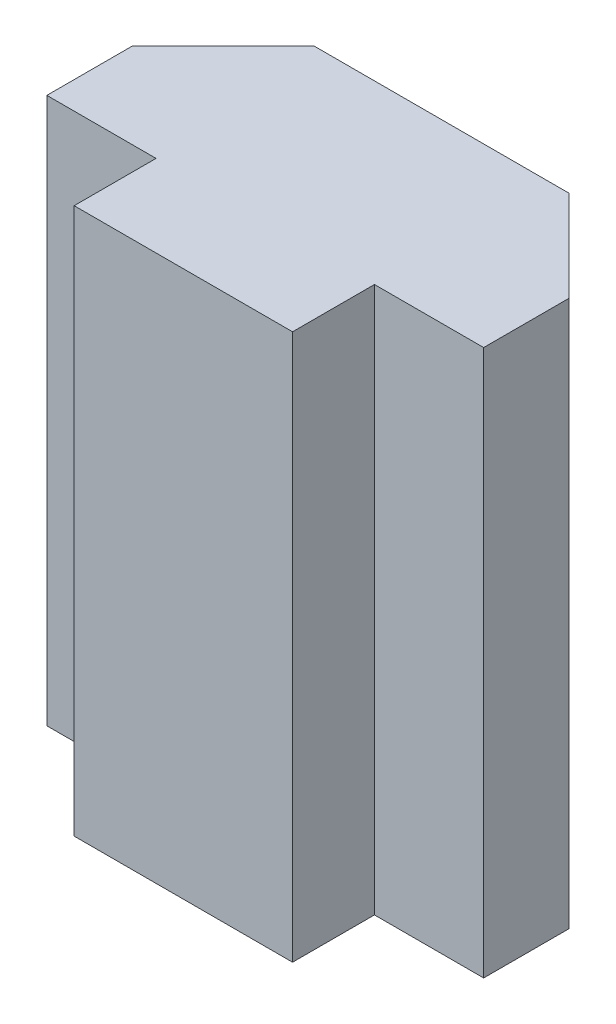
from build123d import *

# Parameters (mm, degrees)
BOSS_EXTRUDE1_DEPTH          = 40
SKETCH2_W                    = 3.5
SKETCH2_H                    = 40
BOSS_EXTRUDE2_DEPTH          = 5
SKETCH4_R                    = 2
CUT_EXTRUDE1_DEPTH           = 7
SKETCH5_R                    = 3.5
CUT_EXTRUDE2_DEPTH           = 3
CUT_EXTRUDE2_DRAFT           = -27
CUT_EXTRUDE2_PROFILE_2_DEPTH = 3
CUT_EXTRUDE2_PROFILE_2_DRAFT = -27
BOSS_EXTRUDE3_DEPTH          = 3
SKETCH9_W                    = 13
SKETCH9_H                    = 40
CUT_EXTRUDE4_DEPTH           = 4.702585656
SKETCH10_W                   = 15
SKETCH10_H                   = 40
BOSS_EXTRUDE4_DEPTH          = 2.5
SKETCH11_W                   = 1.5
SKETCH11_H                   = 2.202585656
BOSS_EXTRUDE7_DEPTH          = 40
BOSS_EXTRUDE8_DEPTH          = 0.625841469
SKETCH13_R                   = 2
CUT_EXTRUDE5_DEPTH           = 10
SKETCH14_W                   = 2.5
SKETCH14_H                   = 40
BOSS_EXTRUDE9_DEPTH          = 0.5
SKETCH15_W                   = 2.5
SKETCH15_H                   = 40
BOSS_EXTRUDE10_DEPTH         = 0.5
BOSS_EXTRUDE11_DEPTH         = 40
BOSS_EXTRUDE12_DEPTH         = 1.13137085
SKETCH18_R                   = 2
CUT_EXTRUDE6_DEPTH           = 10
SKETCH19_R                   = 3
CUT_EXTRUDE7_DEPTH           = 3
CUT_EXTRUDE7_DRAFT           = -19
CUT_EXTRUDE7_PROFILE_2_DEPTH = 3
CUT_EXTRUDE7_PROFILE_2_DRAFT = -19
SKETCH20_W                   = 5
SKETCH20_H                   = 40
BOSS_EXTRUDE13_DEPTH         = 0.5
SKETCH21_W                   = 5
SKETCH21_H                   = 40
BOSS_EXTRUDE14_DEPTH         = 0.5
SKETCH22_W                   = 7
SKETCH22_H                   = 6.5
SKETCH22_W_2                 = 7.5
CUT_EXTRUDE8_DEPTH           = 20
SKETCH23_R                   = 2
BOSS_EXTRUDE15_DEPTH         = 6.459797975
BOSS_EXTRUDE16_START         = -11.459798
SKETCH24_R                   = 3
BOSS_EXTRUDE16_DEPTH         = 11.459798
SKETCH25_W                   = 4
SKETCH25_H                   = 20
CUT_EXTRUDE9_DEPTH           = 20
SKETCH26_W                   = 8
SKETCH26_H                   = 20
CUT_EXTRUDE10_DEPTH          = 1
SKETCH28_W                   = 8
SKETCH28_H                   = 20
CUT_EXTRUDE11_DEPTH          = 1


with BuildPart() as part:
    # Sketch1 → Boss-Extrude1 (new body)
    with BuildSketch(Plane(origin=(0, 0, 0), x_dir=(1, 0, 0), z_dir=(0, 1, 0))):
        Polygon((-4.247892457, 4.702585656), (8.752107543, 4.702585656), (8.752107543, 1.702585656), (7.049521887, 0), (-2.545306801, 0), (-4.247892457, 1.702585656), align=None)
    extrude(amount=BOSS_EXTRUDE1_DEPTH)

    # Sketch2 → Boss-Extrude2 (add)
    with BuildSketch(Plane.XY):
        with Locations((4.002107543, 20)):
            Rectangle(SKETCH2_W, SKETCH2_H)
        with Locations((0.502107543, 20)):
            Rectangle(SKETCH2_W, SKETCH2_H)
    extrude(amount=BOSS_EXTRUDE2_DEPTH)

    # Sketch4 → Cut-Extrude1 (cut)
    with BuildSketch(Plane.XY.offset(5)):
        with Locations((2.252107543, 30)):
            Circle(SKETCH4_R)
        with Locations((2.252107543, 10)):
            Circle(SKETCH4_R)
    extrude(amount=-CUT_EXTRUDE1_DEPTH, mode=Mode.SUBTRACT)


with BuildPart() as cut_extrude2_tool:
    # Sketch5 → Cut-Extrude2 (with draft: the straight prism first)
    with BuildSketch(Plane(origin=(0, 0, -4.702585656), x_dir=(-1, 0, 0), z_dir=(0, 0, -1))):
        with Locations((-2.252107543, 30)):
            Circle(SKETCH5_R)
    extrude(amount=-CUT_EXTRUDE2_DEPTH)
    # Cut-Extrude2: the draft: its side faces are tilted about the plane it starts from
    cut_extrude2_sides = [cut_extrude2_tool.faces().sort_by_distance(p)[0] for p in [
        (5.752107543, 30, -3.202585656),
    ]]
    draft(cut_extrude2_sides, Plane(origin=(0, 0, -4.702585656), x_dir=(-1, 0, 0), z_dir=(0, 0, -1)), CUT_EXTRUDE2_DRAFT)


with BuildPart() as part_1:
    add(part.part)

    # Cut-Extrude2: cut by cut_extrude2_tool
    add(cut_extrude2_tool.part, mode=Mode.SUBTRACT)


with BuildPart() as cut_extrude2_profile_2_tool:
    # Sketch5 → Cut-Extrude2 profile 2 (with draft: the straight prism first)
    with BuildSketch(Plane(origin=(0, 0, -4.702585656), x_dir=(-1, 0, 0), z_dir=(0, 0, -1))):
        with Locations((-2.252107543, 10)):
            Circle(SKETCH5_R)
    extrude(amount=-CUT_EXTRUDE2_PROFILE_2_DEPTH)
    # Cut-Extrude2 profile 2: the draft: its side faces are tilted about the plane it starts from
    cut_extrude2_profile_2_sides = [cut_extrude2_profile_2_tool.faces().sort_by_distance(p)[0] for p in [
        (5.752107543, 10, -3.202585656),
    ]]
    draft(cut_extrude2_profile_2_sides, Plane(origin=(0, 0, -4.702585656), x_dir=(-1, 0, 0), z_dir=(0, 0, -1)), CUT_EXTRUDE2_PROFILE_2_DRAFT)


with BuildPart() as part_2:
    add(part_1.part)

    # Cut-Extrude2 profile 2: cut by cut_extrude2_profile_2_tool
    add(cut_extrude2_profile_2_tool.part, mode=Mode.SUBTRACT)

    # Sketch7 → Boss-Extrude3 (add)
    with BuildSketch(Plane(origin=(0, 0, -4.702585656), x_dir=(-1, 0, 0), z_dir=(0, 0, -1))):
        Polygon((1.247892457, 46.5), (-5.752107543, 46.5), (-5.752107543, 40), (-4.252107543, 40), (-4.252107543, 45), (-0.252107543, 45), (-0.252107543, 43.275204256), (-0.252107543, 40), (1.247892457, 40), align=None)
        Polygon((-4.252107543, 0), (-5.752107543, 0), (-5.752107543, -6.5), (1.247892457, -6.5), (1.247892457, 0), (-0.252107543, 0), (-0.252107543, -5), (-4.252107543, -5), align=None)
    extrude(amount=-BOSS_EXTRUDE3_DEPTH)

    # Sketch9 → Cut-Extrude4 (cut)
    with BuildSketch(Plane(origin=(0, 0, -4.702585656), x_dir=(-1, 0, 0), z_dir=(0, 0, -1))):
        with Locations((-2.252107543, 20)):
            Rectangle(SKETCH9_W, SKETCH9_H)
    extrude(amount=-CUT_EXTRUDE4_DEPTH, mode=Mode.SUBTRACT)


with BuildPart() as cut_extrude4_piece_1:
    # of the separate pieces the step leaves, piece 1, a body of its own (cut_extrude4_pieces)
    add(part_2.part.solids().sort_by_distance((-1.247892457, 0, 0))[0])



with BuildPart() as cut_extrude4_piece_2:
    # of the separate pieces the step leaves, piece 2, a body of its own (cut_extrude4_pieces)
    add(part_2.part.solids().sort_by_distance((0.252107543, 40, -4.702585656))[0])


with BuildPart() as cut_extrude4_piece_3:
    # of the separate pieces the step leaves, piece 3, a body of its own (cut_extrude4_pieces)
    add(part_2.part.solids().sort_by_distance((-1.247892457, -6.5, -4.702585656))[0])


with BuildPart() as cut_extrude4_piece_1_1:
    add(cut_extrude4_piece_1.part)

    add(cut_extrude4_piece_2.part)  # Boss-Extrude4 merges Cut-Extrude4 piece 2

    add(cut_extrude4_piece_3.part)  # Boss-Extrude4 merges Cut-Extrude4 piece 3
    # Sketch10 → Boss-Extrude4 (add)
    with BuildSketch(Plane(origin=(0, 0, 0), x_dir=(-1, 0, 0), z_dir=(0, 0, -1))):
        with Locations((-2.252107543, 20)):
            Rectangle(SKETCH10_W, SKETCH10_H)
    extrude(amount=BOSS_EXTRUDE4_DEPTH)

    # Sketch11 → Boss-Extrude7 (add)
    with BuildSketch(Plane(origin=(0, 0, 0), x_dir=(1, 0, 0), z_dir=(0, 1, 0))):
        with Locations((5.002107543, 3.601292828)):
            Rectangle(SKETCH11_W, SKETCH11_H)
        Polygon((-2.419465332, 5.328427125), (-5.247892457, 2.5), (4.252107543, 2.5), (4.252107543, 4.702585656), (5.752107543, 4.702585656), (5.752107543, 2.5), (9.752107543, 2.5), (6.923680418, 5.328427125), align=None)
    extrude(amount=BOSS_EXTRUDE7_DEPTH)

    # Sketch12 → Boss-Extrude8 (add)
    with BuildSketch(Plane(origin=(0, 0, -4.702585656), x_dir=(-1, 0, 0), z_dir=(0, 0, -1))):
        Polygon((-5.752107543, 0), (-5.752107543, -6.5), (1.247892457, -6.5), (1.247892457, 0), (-0.252107543, 0), (-0.252107543, -5), (-4.252107543, -5), (-4.252107543, 0), align=None)
        Polygon((1.247892457, 46.5), (-5.752107543, 46.5), (-5.752107543, 40), (-4.252107543, 40), (-4.252107543, 45), (-0.252107543, 45), (-0.252107543, 40), (1.247892457, 40), align=None)
    extrude(amount=BOSS_EXTRUDE8_DEPTH)

    # Sketch13 → Cut-Extrude5 (cut)
    with BuildSketch(Plane.XY):
        with Locations((2.252107543, 30)):
            Circle(SKETCH13_R)
        with Locations((2.252107543, 10)):
            Circle(SKETCH13_R)
    extrude(amount=-CUT_EXTRUDE5_DEPTH, mode=Mode.SUBTRACT)

    # Sketch14 → Boss-Extrude9 (add)
    with BuildSketch(Plane(origin=(9.752107543, 0, 0), x_dir=(0, 0, -1), z_dir=(1, 0, 0))):
        with Locations((1.25, 20)):
            Rectangle(SKETCH14_W, SKETCH14_H)
    extrude(amount=BOSS_EXTRUDE9_DEPTH)

    # Sketch15 → Boss-Extrude10 (add)
    with BuildSketch(Plane.ZY.offset(5.247892457)):
        with Locations((-1.25, 20)):
            Rectangle(SKETCH15_W, SKETCH15_H)
    extrude(amount=BOSS_EXTRUDE10_DEPTH)

    # Sketch16 → Boss-Extrude11 (add)
    with BuildSketch(Plane.XZ):
        Polygon((-2.419465332, -5.328427125), (-5.247892457, -2.5), (-5.747892457, -2.5), (-5.747892457, -3.13137085), (-2.419465332, -6.459797975), (6.923680418, -6.459797975), (10.252107543, -3.13137085), (10.252107543, -2.5), (9.752107543, -2.5), (6.923680418, -5.328427125), (0.656985658, -5.328427125), align=None)
    extrude(amount=-BOSS_EXTRUDE11_DEPTH)

    # Sketch17 → Boss-Extrude12 (add)
    with BuildSketch(Plane(origin=(0, 0, -5.328427125), x_dir=(-1, 0, 0), z_dir=(0, 0, -1))):
        Polygon((-5.752107543, 0), (-5.752107543, -6.5), (1.247892457, -6.5), (1.247892457, 0), (0, 0), (0, -5), (-0.252107543, -5), (-4.252107543, -5), (-4.252107543, 0), align=None)
        Polygon((1.247892457, 46.5), (-5.752107543, 46.5), (-5.752107543, 40), (-4.252107543, 40), (-4.252107543, 44.953142187), (-0.252107543, 44.953142187), (-0.252107543, 40), (1.247892457, 40), align=None)
    extrude(amount=BOSS_EXTRUDE12_DEPTH)

    # Sketch18 → Cut-Extrude6 (cut)
    with BuildSketch(Plane.XY.offset(-5.328427125)):
        with Locations((2.252107543, 30)):
            Circle(SKETCH18_R)
        with Locations((2.252107543, 10)):
            Circle(SKETCH18_R)
    extrude(amount=-CUT_EXTRUDE6_DEPTH, mode=Mode.SUBTRACT)


with BuildPart() as cut_extrude7_tool:
    # Sketch19 → Cut-Extrude7 (with draft: the straight prism first)
    with BuildSketch(Plane(origin=(0, 0, -6.459797975), x_dir=(-1, 0, 0), z_dir=(0, 0, -1))):
        with Locations((-2.252107543, 30)):
            Circle(SKETCH19_R)
    extrude(amount=-CUT_EXTRUDE7_DEPTH)
    # Cut-Extrude7: the draft: its side faces are tilted about the plane it starts from
    cut_extrude7_sides = [cut_extrude7_tool.faces().sort_by_distance(p)[0] for p in [
        (5.252107543, 30, -4.959797975),
    ]]
    draft(cut_extrude7_sides, Plane(origin=(0, 0, -6.459797975), x_dir=(-1, 0, 0), z_dir=(0, 0, -1)), CUT_EXTRUDE7_DRAFT)


with BuildPart() as cut_extrude4_piece_1_2:
    add(cut_extrude4_piece_1_1.part)

    # Cut-Extrude7: cut by cut_extrude7_tool
    add(cut_extrude7_tool.part, mode=Mode.SUBTRACT)


with BuildPart() as cut_extrude7_profile_2_tool:
    # Sketch19 → Cut-Extrude7 profile 2 (with draft: the straight prism first)
    with BuildSketch(Plane(origin=(0, 0, -6.459797975), x_dir=(-1, 0, 0), z_dir=(0, 0, -1))):
        with Locations((-2.252107543, 10)):
            Circle(SKETCH19_R)
    extrude(amount=-CUT_EXTRUDE7_PROFILE_2_DEPTH)
    # Cut-Extrude7 profile 2: the draft: its side faces are tilted about the plane it starts from
    cut_extrude7_profile_2_sides = [cut_extrude7_profile_2_tool.faces().sort_by_distance(p)[0] for p in [
        (5.252107543, 10, -4.959797975),
    ]]
    draft(cut_extrude7_profile_2_sides, Plane(origin=(0, 0, -6.459797975), x_dir=(-1, 0, 0), z_dir=(0, 0, -1)), CUT_EXTRUDE7_PROFILE_2_DRAFT)


with BuildPart() as cut_extrude4_piece_1_3:
    add(cut_extrude4_piece_1_2.part)

    # Cut-Extrude7 profile 2: cut by cut_extrude7_profile_2_tool
    add(cut_extrude7_profile_2_tool.part, mode=Mode.SUBTRACT)

    # Sketch20 → Boss-Extrude13 (add)
    with BuildSketch(Plane.ZY.offset(1.247892457)):
        with Locations((2.5, 20)):
            Rectangle(SKETCH20_W, SKETCH20_H)
    extrude(amount=BOSS_EXTRUDE13_DEPTH)

    # Sketch21 → Boss-Extrude14 (add)
    with BuildSketch(Plane(origin=(5.752107543, 0, 0), x_dir=(0, 0, -1), z_dir=(1, 0, 0))):
        with Locations((-2.5, 20)):
            Rectangle(SKETCH21_W, SKETCH21_H)
    extrude(amount=BOSS_EXTRUDE14_DEPTH)

    # Sketch22 → Cut-Extrude8 (cut)
    with BuildSketch(Plane.XY.offset(5)):
        with Locations((2.252107543, 43.25)):
            Rectangle(SKETCH22_W, SKETCH22_H)
        with Locations((2.502107543, -3.25)):
            Rectangle(SKETCH22_W_2, SKETCH22_H)
    extrude(amount=-CUT_EXTRUDE8_DEPTH, mode=Mode.SUBTRACT)

    # Sketch23 → Boss-Extrude15 (add)
    with BuildSketch(Plane.XY):
        with Locations((2.252107543, 10)):
            Circle(SKETCH23_R)
        with Locations((2.252107543, 30)):
            Circle(SKETCH23_R)
    extrude(amount=-BOSS_EXTRUDE15_DEPTH)

    # Sketch24 → Boss-Extrude16 (add)
    with BuildSketch(Plane(origin=(0, 0, -6.459797975), x_dir=(-1, 0, 0), z_dir=(0, 0, -1)).offset(BOSS_EXTRUDE16_START)):
        with Locations((-2.252107543, 30)):
            Circle(SKETCH24_R)
        with Locations((-2.252107543, 10)):
            Circle(SKETCH24_R)
    extrude(amount=BOSS_EXTRUDE16_DEPTH)

    # Sketch25 → Cut-Extrude9 (cut)
    with BuildSketch(Plane.XY.offset(5)):
        Polygon((6.252107543, 20.358230215), (6.252107543, 20), (10.252107543, 20), (10.252107543, 40), (6.252107543, 40), align=None)
        Polygon((-1.747892457, 20), (6.252107543, 20), (6.252107543, 20.358230215), (6.252107543, 40), (-1.747892457, 40), align=None)
        with Locations((-3.747892457, 30)):
            Rectangle(SKETCH25_W, SKETCH25_H)
    extrude(amount=-CUT_EXTRUDE9_DEPTH, mode=Mode.SUBTRACT)

    # Sketch26 → Cut-Extrude10 (cut)
    with BuildSketch(Plane.XY.offset(5)):
        with Locations((2.252107543, 10)):
            Rectangle(SKETCH26_W, SKETCH26_H)
    extrude(amount=-CUT_EXTRUDE10_DEPTH, mode=Mode.SUBTRACT)

    # Sketch28 → Cut-Extrude11 (cut)
    with BuildSketch(Plane.XY.offset(4)):
        with Locations((2.252107543, 10)):
            Rectangle(SKETCH28_W, SKETCH28_H)
    extrude(amount=-CUT_EXTRUDE11_DEPTH, mode=Mode.SUBTRACT)


solid = cut_extrude4_piece_1_3.part
